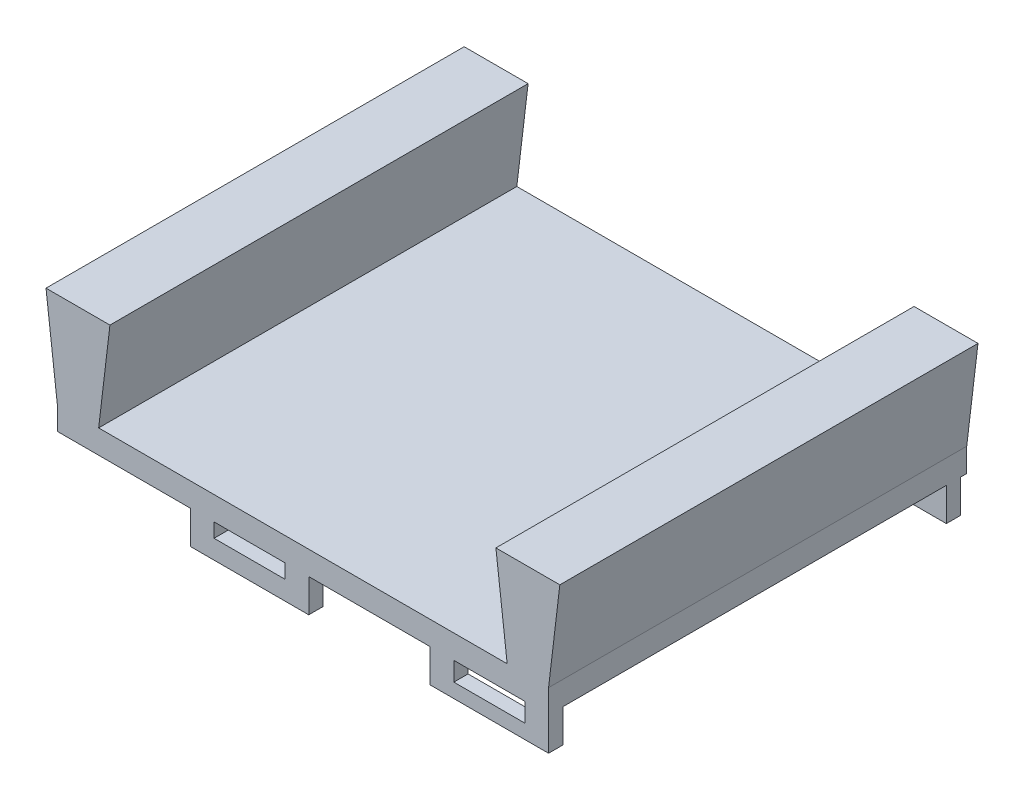
from build123d import *

# Parameters (mm, degrees)
BOSS_EXTRUDE1_DEPTH   = 88.3
BOSS_EXTRUDE1_2_DEPTH = 88.3
SKETCH2_W             = 103.737369208
SKETCH2_H             = 88.3
BOSS_EXTRUDE2_DEPTH   = 5
SKETCH4_W             = 25
SKETCH4_H             = 3
BOSS_EXTRUDE4_DEPTH   = 7
SKETCH6_W             = 15
SKETCH6_H             = 3
SKETCH6_H_2           = 3.987889175
CUT_EXTRUDE2_DEPTH    = 97


with BuildPart() as part:
    # Sketch1 → Boss-Extrude1 (new body)
    with BuildSketch(Plane.XY):
        Polygon((-51.868684604, 0), (-47.5, 0), (-43.131315396, 0), (-40.75, 20), (-54.25, 20), align=None)
    extrude(amount=-BOSS_EXTRUDE1_DEPTH)



with BuildPart() as body_2:
    # Sketch1 → Boss-Extrude1 2 (new body)
    with BuildSketch(Plane.XY):
        Polygon((40.75, 20), (43.131315396, 0), (47.5, 0), (51.868684604, 0), (54.25, 20), align=None)
    extrude(amount=-BOSS_EXTRUDE1_2_DEPTH)


with BuildPart() as part_1:
    add(part.part)

    add(body_2.part)  # Boss-Extrude2 merges body 2
    # Sketch2 → Boss-Extrude2 (add)
    with BuildSketch(Plane.XZ):
        with Locations((0, -44.15)):
            Rectangle(SKETCH2_W, SKETCH2_H)
    extrude(amount=BOSS_EXTRUDE2_DEPTH)

    # Sketch4 → Boss-Extrude4 (add)
    with BuildSketch(Plane.XZ.offset(5)):
        with Locations((39.368684604, -1.5)):
            Rectangle(SKETCH4_W, SKETCH4_H)
        with Locations((-11.265529701, -1.5)):
            Rectangle(SKETCH4_W, SKETCH4_H)
        with Locations((39.368684604, -85.5)):
            Rectangle(SKETCH4_W, SKETCH4_H)
        with Locations((-11.265529701, -85.5)):
            Rectangle(SKETCH4_W, SKETCH4_H)
    extrude(amount=BOSS_EXTRUDE4_DEPTH)

    # Sketch6 → Cut-Extrude2 (cut)
    with BuildSketch(Plane(origin=(0, 0, -87), x_dir=(-1, 0, 0), z_dir=(0, 0, -1))):
        with Locations((11.265529701, -6.5)):
            Rectangle(SKETCH6_W, SKETCH6_H)
        with Locations((-39.368684604, -6.993944588)):
            Rectangle(SKETCH6_W, SKETCH6_H_2)
    extrude(amount=-CUT_EXTRUDE2_DEPTH, mode=Mode.SUBTRACT)


solid = part_1.part
